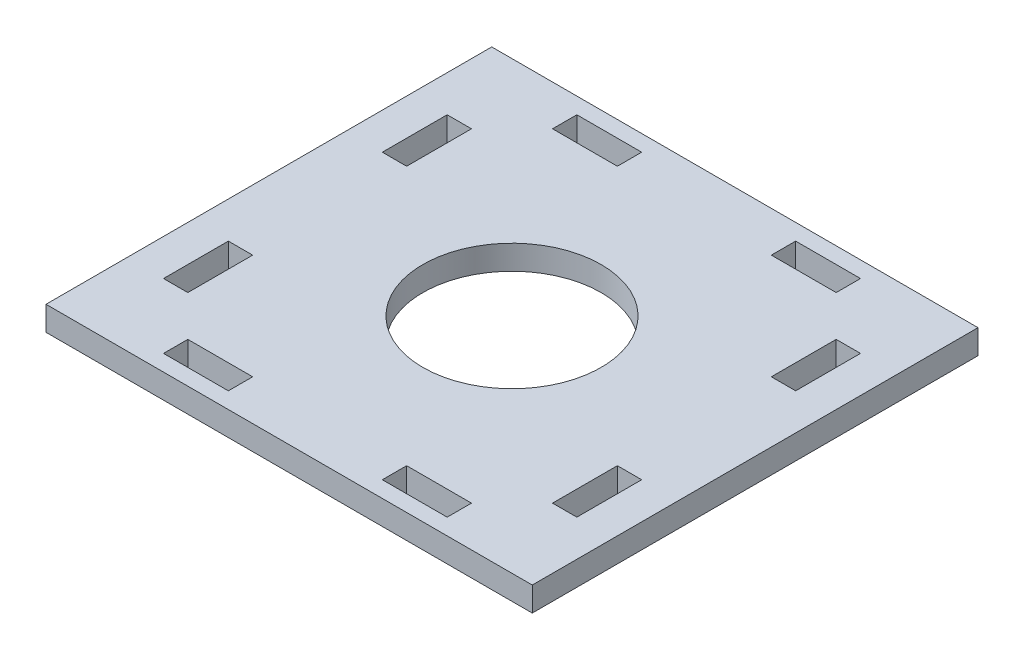
from build123d import *

# Parameters (mm, degrees)
SKETCH_1_R          = 2
SKETCH_1_W          = 3
SKETCH_1_H          = 8
SKETCH_1_W_2        = 8
SKETCH_1_H_2        = 3
EXTRUDE_1_DEPTH     = 3
SKETCH_2_W          = 60
SKETCH_2_H          = 50
CUT_EXTRUDE_1_DEPTH = 10
SKETCH_3_R          = 11
CUT_EXTRUDE_2_DEPTH = 10


with BuildPart() as part:
    # 草图1 → 凸台-拉伸1 (new body)
    with BuildSketch(Plane(origin=(0, 0, 0), x_dir=(1, 0, 0), z_dir=(0, 1, 0))):
        Polygon((-30, -27.5), (-10, -72.5), (10, -72.5), (30, -27.5), (30, 27.5), (-30, 27.5), align=None)
        with Locations(Location((0, -37.5, 0), (0, 0, 270))):
            Circle(SKETCH_1_R, mode=Mode.SUBTRACT)
        with Locations(Location((0, -57.5, 0), (0, 0, 270))):
            Circle(SKETCH_1_R, mode=Mode.SUBTRACT)
        with Locations((-24, 13.5)):
            Rectangle(SKETCH_1_W, SKETCH_1_H, mode=Mode.SUBTRACT)
        with Locations((-24, -13.5)):
            Rectangle(SKETCH_1_W, SKETCH_1_H, mode=Mode.SUBTRACT)
        with Locations((13.5, 24)):
            Rectangle(SKETCH_1_W_2, SKETCH_1_H_2, mode=Mode.SUBTRACT)
        with Locations((-13.5, 24)):
            Rectangle(SKETCH_1_W_2, SKETCH_1_H_2, mode=Mode.SUBTRACT)
        with Locations((-13.5, -24)):
            Rectangle(SKETCH_1_W_2, SKETCH_1_H_2, mode=Mode.SUBTRACT)
        with Locations((13.5, -24)):
            Rectangle(SKETCH_1_W_2, SKETCH_1_H_2, mode=Mode.SUBTRACT)
        with Locations((24, 13.5)):
            Rectangle(SKETCH_1_W, SKETCH_1_H, mode=Mode.SUBTRACT)
        with Locations((24, -13.5)):
            Rectangle(SKETCH_1_W, SKETCH_1_H, mode=Mode.SUBTRACT)
    extrude(amount=EXTRUDE_1_DEPTH)

    # 草图2 → 切除-拉伸1 (cut)
    with BuildSketch(Plane(origin=(0, 3, 0), x_dir=(1, 0, 0), z_dir=(0, 1, 0))):
        with Locations((0, -52.5)):
            Rectangle(SKETCH_2_W, SKETCH_2_H)
    extrude(amount=-CUT_EXTRUDE_1_DEPTH, mode=Mode.SUBTRACT)

    # 草图3 → 切除-拉伸2 (cut)
    with BuildSketch(Plane(origin=(0, 3, 0), x_dir=(1, 0, 0), z_dir=(0, 1, 0))):
        with Locations(Location((0, 0, 0), (0, 0, 270))):
            Circle(SKETCH_3_R)
    extrude(amount=-CUT_EXTRUDE_2_DEPTH, mode=Mode.SUBTRACT)


solid = part.part
